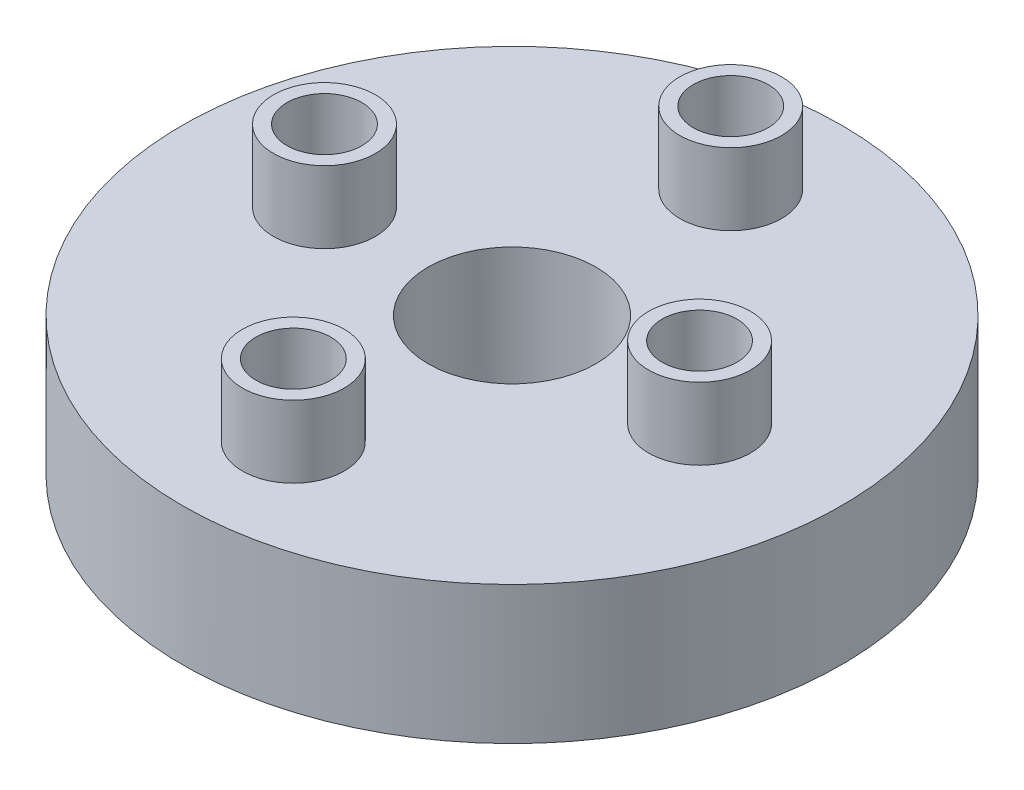
from build123d import *

# Parameters (mm, degrees)
SKETCH1_R           = 13.97
SKETCH1_R_2         = 3.556
SKETCH1_R_3         = 1.5875
BOSS_EXTRUDE4_DEPTH = 2.54
SKETCH2_R           = 2.159
SKETCH2_R_2         = 1.5875
BOSS_EXTRUDE6_DEPTH = 3.048
BOSS_EXTRUDE7_START = 3.302
SKETCH3_R           = 13.97
SKETCH3_R_2         = 2.921
BOSS_EXTRUDE7_DEPTH = 3.302


with BuildPart() as part:
    # Sketch1 → Boss-Extrude4 (new body)
    with BuildSketch(Plane(origin=(0, 0, 0), x_dir=(1, 0, 0), z_dir=(0, 1, 0))):
        with Locations(Location((0, 0, 0), (0, 0, 270))):
            Circle(SKETCH1_R)
        with Locations(Location((0, 0, 0), (0, 0, 270))):
            Circle(SKETCH1_R_2, mode=Mode.SUBTRACT)
        with Locations(Location((-7.9502, 0, 0), (0, 0, 270))):
            Circle(SKETCH1_R_3, mode=Mode.SUBTRACT)
        with Locations(Location((7.9502, 0, 0), (0, 0, 270))):
            Circle(SKETCH1_R_3, mode=Mode.SUBTRACT)
        with Locations(Location((0, 9.271, 0), (0, 0, 270))):
            Circle(SKETCH1_R_3, mode=Mode.SUBTRACT)
        with Locations(Location((0, -9.271, 0), (0, 0, 270))):
            Circle(SKETCH1_R_3, mode=Mode.SUBTRACT)
    extrude(amount=BOSS_EXTRUDE4_DEPTH)

    # Sketch2 → Boss-Extrude6 (add)
    # profile 1 of 4: a face of its own
    with BuildSketch(Plane(origin=(0, 2.54, 0), x_dir=(1, 0, 0), z_dir=(0, 1, 0))):
        with Locations(Location((0, 9.271, 0), (0, 0, 90))):
            Circle(SKETCH2_R)
        with Locations(Location((0, 9.271, 0), (0, 0, 270))):
            Circle(SKETCH2_R_2, mode=Mode.SUBTRACT)
    # profile 2 of 4: a face of its own
    with BuildSketch(Plane(origin=(0, 2.54, 0), x_dir=(1, 0, 0), z_dir=(0, 1, 0))):
        with Locations(Location((7.9502, 0, 0), (0, 0, 90))):
            Circle(SKETCH2_R)
        with Locations(Location((7.9502, 0, 0), (0, 0, 270))):
            Circle(SKETCH2_R_2, mode=Mode.SUBTRACT)
    # profile 3 of 4: a face of its own
    with BuildSketch(Plane(origin=(0, 2.54, 0), x_dir=(1, 0, 0), z_dir=(0, 1, 0))):
        with Locations(Location((-7.9502, 0, 0), (0, 0, 90))):
            Circle(SKETCH2_R)
        with Locations(Location((-7.9502, 0, 0), (0, 0, 270))):
            Circle(SKETCH2_R_2, mode=Mode.SUBTRACT)
    # profile 4 of 4: a face of its own
    with BuildSketch(Plane(origin=(0, 2.54, 0), x_dir=(1, 0, 0), z_dir=(0, 1, 0))):
        with Locations(Location((0, -9.271, 0), (0, 0, 90))):
            Circle(SKETCH2_R)
        with Locations(Location((0, -9.271, 0), (0, 0, 270))):
            Circle(SKETCH2_R_2, mode=Mode.SUBTRACT)
    extrude(amount=BOSS_EXTRUDE6_DEPTH)

    # Sketch3 → Boss-Extrude7 (add)
    with BuildSketch(Plane(origin=(0, 0, 0), x_dir=(-1, 0, 0), z_dir=(0, -1, 0)).offset(BOSS_EXTRUDE7_START)):
        with Locations(Location((0, 0, 0), (0, 0, 90))):
            Circle(SKETCH3_R)
        with Locations(Location((0, -9.271, 0), (0, 0, 270))):
            Circle(SKETCH3_R_2, mode=Mode.SUBTRACT)
        with Locations(Location((-7.9502, 0, 0), (0, 0, 270))):
            Circle(SKETCH3_R_2, mode=Mode.SUBTRACT)
        with BuildLine():
            ThreePointArc((-3.556, 0), (-2.514471714, 2.514471714), (0, 3.556))
            ThreePointArc((0, 3.556), (2.514471714, 2.514471714), (3.556, 0))
            ThreePointArc((3.556, 0), (0, -3.556), (-3.556, 0))
        make_face(mode=Mode.SUBTRACT)
        with Locations(Location((7.9502, 0, 0), (0, 0, 270))):
            Circle(SKETCH3_R_2, mode=Mode.SUBTRACT)
        with BuildLine():
            ThreePointArc((2.921, 9.271), (2.065458908, 7.205541092), (0, 6.35))
            ThreePointArc((0, 6.35), (-2.065458908, 11.336458908), (2.921, 9.271))
        make_face(mode=Mode.SUBTRACT)
    extrude(amount=-BOSS_EXTRUDE7_DEPTH)


solid = part.part
